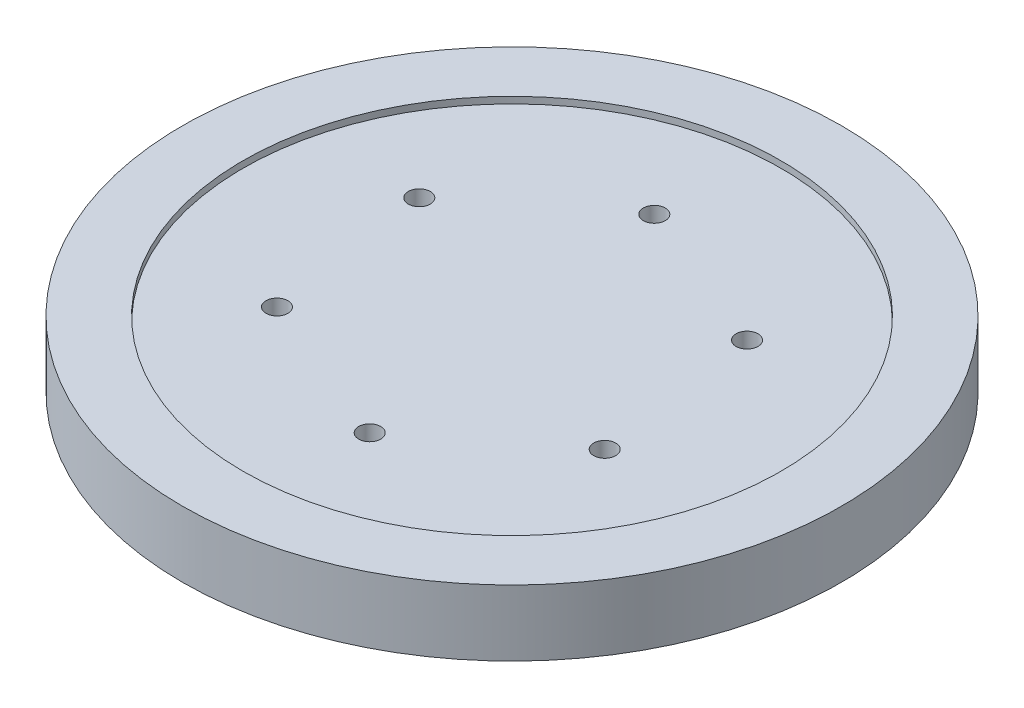
from build123d import *

# Parameters (mm, degrees)
CROQUIS1_R                 = 75
CROQUIS1_R_2               = 61.225
SALIENTE_EXTRUIR1_DEPTH    = 15
CORTAR_EXTRUIR3_START      = 15
CROQUIS1_4_OUTSIDE_W       = 194.532
CROQUIS1_4_OUTSIDE_H       = 194.532
CROQUIS1_4_OUTSIDE_R       = 75
CROQUIS1_4_OUTSIDE_R_2     = 61.225
CORTAR_EXTRUIR3_DEPTH      = 1.5
CORTAR_EXTRUIR5_DEPTH      = 107.921700323
CORTAR_EXTRUIR5_DEPTH_BACK = 107.921700323
CROQUIS2_R                 = 2.5
CORTAR_EXTRUIR6_DEPTH      = 5.2
CORTAR_EXTRUIR6_DEPTH_BACK = 107.921700323
CORTAR_EXTRUIR6_START      = -13.5
CROQUIS2_4_R               = 4.25
CROQUIS3_R                 = 2.5
CORTAR_EXTRUIR7_DEPTH      = 10


with BuildPart() as part:
    # Croquis1 → Saliente-Extruir1 (new body)
    # profile 1 of 2: a face of its own
    with BuildSketch(Plane(origin=(0, 0, 0), x_dir=(1, 0, 0), z_dir=(0, 1, 0))):
        with Locations(Location((0, 0, 0), (0, 0, 270))):
            Circle(CROQUIS1_R)
        Circle(CROQUIS1_R_2, mode=Mode.SUBTRACT)
    # profile 2 of 2: a face of its own
    with BuildSketch(Plane(origin=(0, 0, 0), x_dir=(1, 0, 0), z_dir=(0, 1, 0))):
        Circle(CROQUIS1_R_2)
    extrude(amount=SALIENTE_EXTRUIR1_DEPTH)

    # Croquis1<4> outside → Cortar-Extruir3 (cut)
    # profile 1 of 2: a face of its own
    with BuildSketch(Plane(origin=(0, 0, 0), x_dir=(1, 0, 0), z_dir=(0, 1, 0)).offset(CORTAR_EXTRUIR3_START)):
        Rectangle(CROQUIS1_4_OUTSIDE_W, CROQUIS1_4_OUTSIDE_H)
        with Locations(Location((0, 0, 0), (0, 0, 270))):
            Circle(CROQUIS1_4_OUTSIDE_R, mode=Mode.SUBTRACT)
    # profile 2 of 2: a face of its own
    with BuildSketch(Plane(origin=(0, 0, 0), x_dir=(1, 0, 0), z_dir=(0, 1, 0)).offset(CORTAR_EXTRUIR3_START)):
        with Locations(Location((0, 0, 0), (0, 0, 270))):
            Circle(CROQUIS1_4_OUTSIDE_R_2)
    extrude(amount=-CORTAR_EXTRUIR3_DEPTH, mode=Mode.SUBTRACT)

    # Croquis2 → Cortar-Extruir5 (cut, two sides: drawn at the far end of the back side and taken through both)
    with BuildSketch(Plane(origin=(0, 13.5, 0), x_dir=(1, 0, 0), z_dir=(0, 1, 0)).offset(-CORTAR_EXTRUIR5_DEPTH_BACK)):
        with Locations(Location((-35.338232438, 14.241465098, 0), (0, 0, 270))):
            Circle(CROQUIS2_R)
        with Locations(Location((-5.335645657, 37.724539565, 0), (0, 0, 270))):
            Circle(CROQUIS2_R)
        with Locations(Location((30.002586781, 23.483074467, 0), (0, 0, 270))):
            Circle(CROQUIS2_R)
        with Locations(Location((35.338232438, -14.241465098, 0), (0, 0, 270))):
            Circle(CROQUIS2_R)
        with Locations(Location((5.335645657, -37.724539565, 0), (0, 0, 270))):
            Circle(CROQUIS2_R)
        with Locations(Location((-30.002586781, -23.483074467, 0), (0, 0, 270))):
            Circle(CROQUIS2_R)
    extrude(amount=CORTAR_EXTRUIR5_DEPTH + CORTAR_EXTRUIR5_DEPTH_BACK, mode=Mode.SUBTRACT)

    # Croquis2<4> → Cortar-Extruir6 (cut, two sides: drawn at the far end of the back side and taken through both)
    with BuildSketch(Plane(origin=(0, 13.5, 0), x_dir=(1, 0, 0), z_dir=(0, 1, 0)).offset(CORTAR_EXTRUIR6_START - CORTAR_EXTRUIR6_DEPTH_BACK)):
        with Locations(Location((-35.338232438, 14.241465098, 0), (0, 0, 270))):
            Circle(CROQUIS2_4_R)
        with Locations((-4.027016235, 36.022318165)):
            Circle(CROQUIS2_4_R)
        with Locations((30.491363939, 19.796436043)):
            Circle(CROQUIS2_4_R)
        with Locations((33.698527909, -18.210299146)):
            Circle(CROQUIS2_4_R)
        with Locations((2.387311706, -39.991152213)):
            Circle(CROQUIS2_4_R)
        with Locations((-32.131068468, -23.765270091)):
            Circle(CROQUIS2_4_R)
    extrude(amount=CORTAR_EXTRUIR6_DEPTH + CORTAR_EXTRUIR6_DEPTH_BACK, mode=Mode.SUBTRACT)

    # Croquis3 → Cortar-Extruir7 (cut)
    with BuildSketch(Plane.XZ):
        with Locations(Location((35.040630993, 53.555151962, 0), (0, 0, 270))):
            Circle(CROQUIS3_R)
        with Locations(Location((-53.555151962, 35.040630993, 0), (0, 0, 270))):
            Circle(CROQUIS3_R)
        with Locations(Location((53.555151962, -35.040630993, 0), (0, 0, 270))):
            Circle(CROQUIS3_R)
        with Locations(Location((-35.040630993, -53.555151962, 0), (0, 0, 270))):
            Circle(CROQUIS3_R)
    extrude(amount=-CORTAR_EXTRUIR7_DEPTH, mode=Mode.SUBTRACT)


solid = part.part
